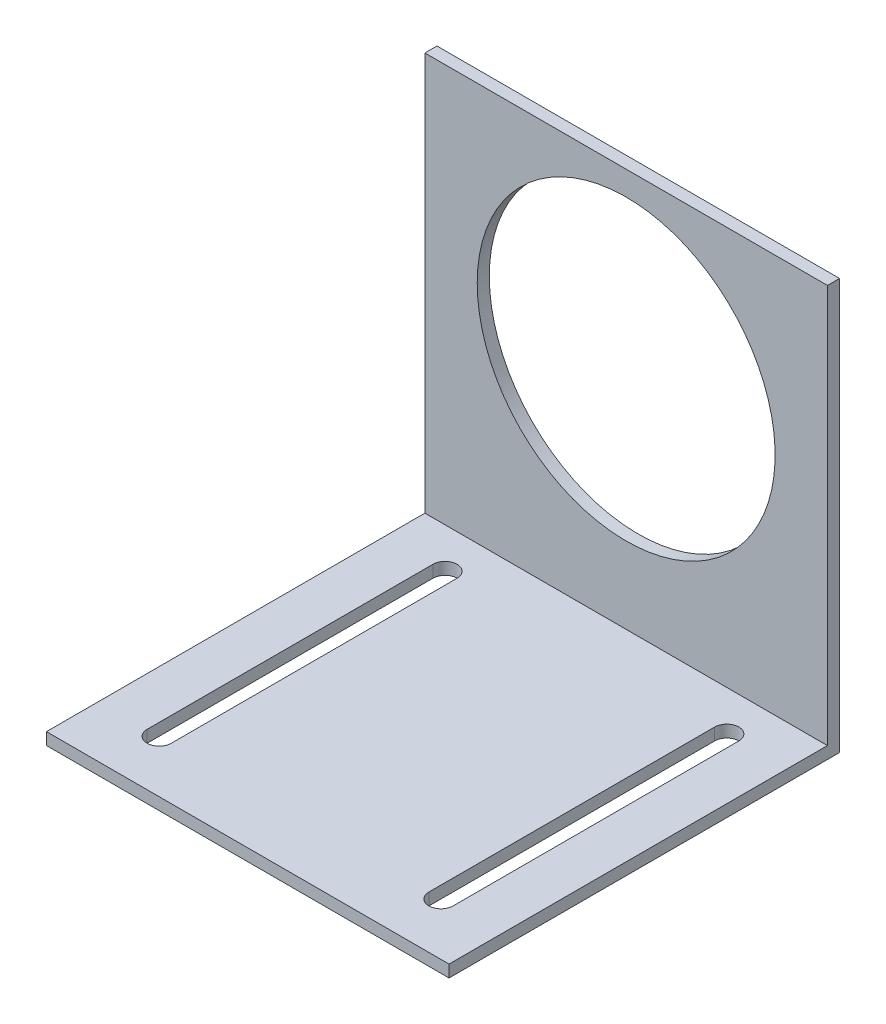
from build123d import *

# Parameters (mm, degrees)
SKETCH1_W           = 100
SKETCH1_H           = 97
BOSS_EXTRUDE1_DEPTH = 3
SKETCH2_W           = 100
SKETCH2_H           = 102
SKETCH2_R           = 37
BOSS_EXTRUDE2_DEPTH = 3


with BuildPart() as part:
    # Sketch1 → Boss-Extrude1 (new body)
    with BuildSketch(Plane(origin=(0, 0, 0), x_dir=(1, 0, 0), z_dir=(0, 1, 0))):
        with Locations((50, 48.5)):
            Rectangle(SKETCH1_W, SKETCH1_H)
        with BuildLine():
            Line((18, 84), (18, 13))
            ThreePointArc((18, 13), (15, 10), (12, 13))
            Line((12, 13), (12, 84))
            ThreePointArc((12, 84), (15, 87), (18, 84))
        make_face(mode=Mode.SUBTRACT)
        with BuildLine():
            Line((82, 13), (82, 84))
            ThreePointArc((82, 84), (85, 87), (88, 84))
            Line((88, 84), (88, 13))
            ThreePointArc((88, 13), (85, 10), (82, 13))
        make_face(mode=Mode.SUBTRACT)
    extrude(amount=BOSS_EXTRUDE1_DEPTH)

    # Sketch2 → Boss-Extrude2 (add)
    with BuildSketch(Plane(origin=(0, 0, -97), x_dir=(-1, 0, 0), z_dir=(0, 0, -1))):
        with Locations((-50, 51)):
            Rectangle(SKETCH2_W, SKETCH2_H)
        with Locations((-50, 59)):
            Circle(SKETCH2_R, mode=Mode.SUBTRACT)
    extrude(amount=-BOSS_EXTRUDE2_DEPTH)


solid = part.part
